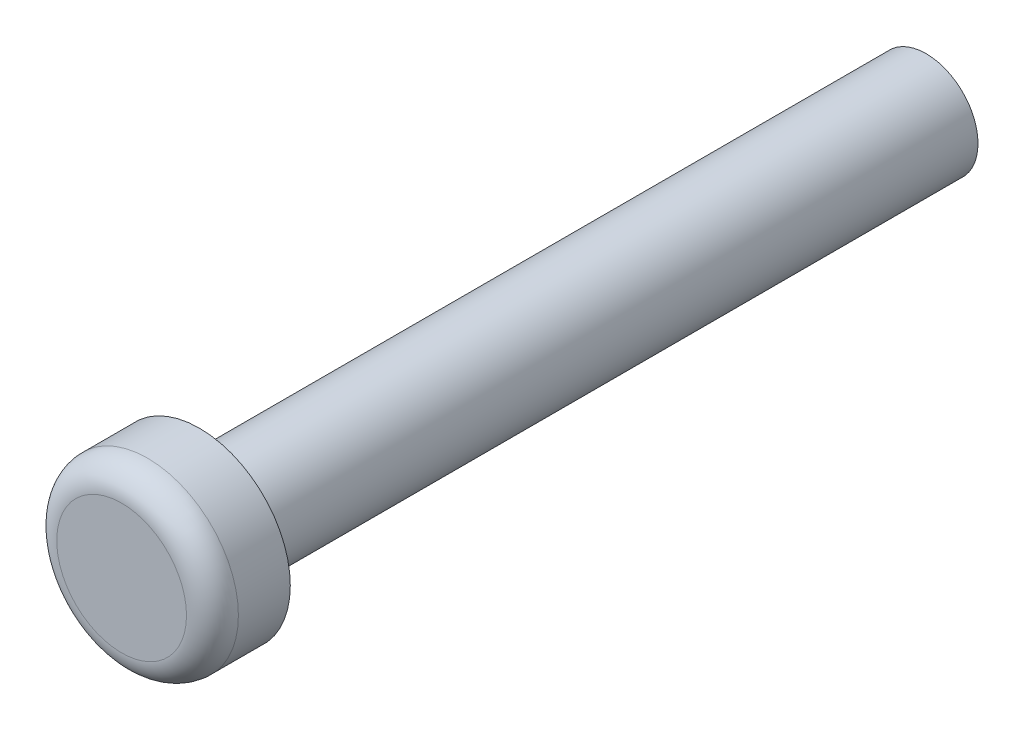
from build123d import *

# Parameters (mm, degrees)
SKETCH1_R           = 4.445
BOSS_EXTRUDE1_DEPTH = 3.81
FILLET2_R           = 1.27
SKETCH2_R           = 2.54
BOSS_EXTRUDE2_DEPTH = 35.56


with BuildPart() as part:
    # Sketch1 → Boss-Extrude1 (new body)
    with BuildSketch(Plane.XY):
        with Locations(Location((0, 0, 0), (0, 0, 180))):
            Circle(SKETCH1_R)
    extrude(amount=BOSS_EXTRUDE1_DEPTH)

    # Fillet2
    fillet2_edges = [part.edges().sort_by_distance(p)[0] for p in [
        (4.445, 0, 3.81),
    ]]
    fillet(fillet2_edges, radius=FILLET2_R)

    # Sketch2 → Boss-Extrude2 (add)
    with BuildSketch(Plane(origin=(0, 0, 0), x_dir=(-1, 0, 0), z_dir=(0, 0, -1))):
        with Locations(Location((0, 0, 0), (0, 0, 180))):
            Circle(SKETCH2_R)
    extrude(amount=BOSS_EXTRUDE2_DEPTH)


solid = part.part
